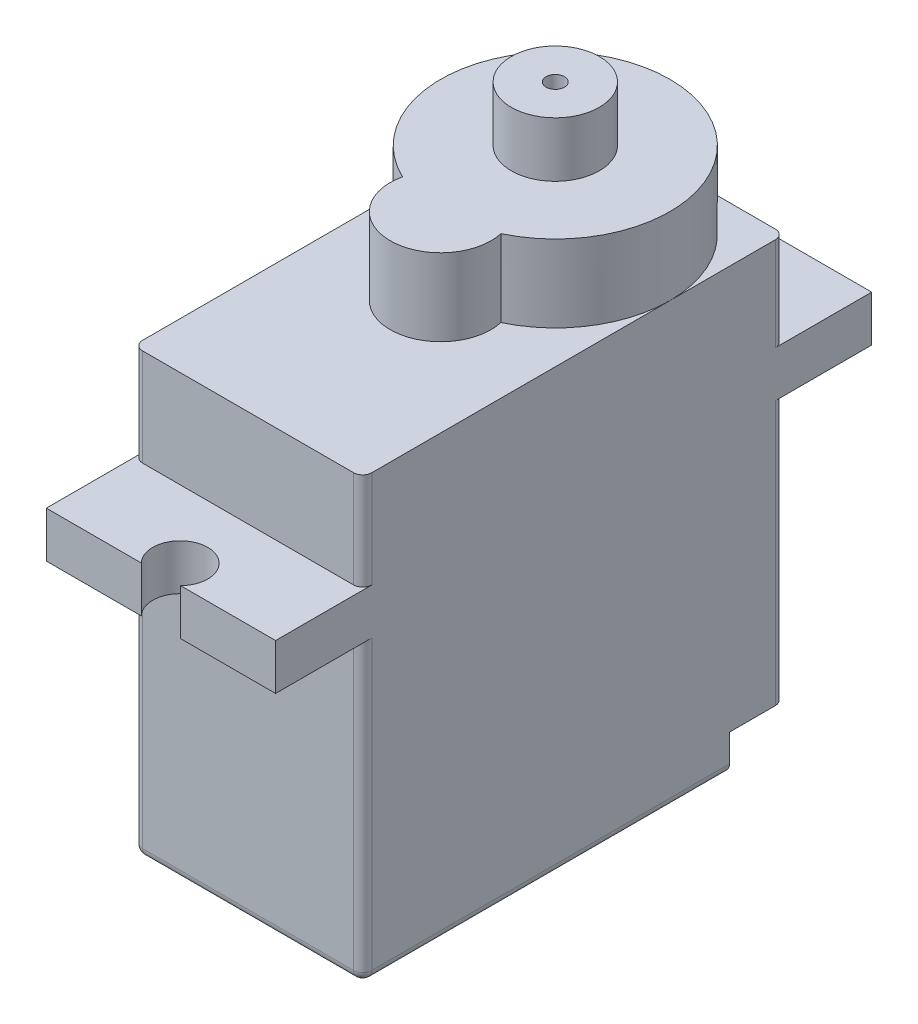
from build123d import *

# Parameters (mm, degrees)
SKETCH1_W                    = 32.5
SKETCH1_H                    = 24
BOSS_EXTRUDE1_DEPTH          = 12.5
BOSS_EXTRUDE2_DEPTH          = 4.2
SKETCH3_W                    = 4.75
SKETCH3_H                    = 5.1
CUT_EXTRUDE1_DEPTH           = 35.864774487
SKETCH4_W                    = 4.75
SKETCH4_H                    = 16.4
CUT_EXTRUDE2_DEPTH           = 35.864774487
SKETCH5_W                    = 4.75
SKETCH5_H                    = 5.3
CUT_EXTRUDE3_DEPTH           = 35.864774487
SKETCH6_W                    = 4.75
SKETCH6_H                    = 16.2
CUT_EXTRUDE4_DEPTH           = 35.864774487
SKETCH7_W                    = 2.3
SKETCH7_H                    = 3
CUT_EXTRUDE5_DEPTH           = 2
SKETCH8_W                    = 2.3
SKETCH8_H                    = 3
CUT_EXTRUDE6_DEPTH           = 2
SKETCH9_W                    = 2.4
SKETCH9_H                    = 3
F_3_0_3_DIAMETER_HOLE1_D     = 3
F_3_0_3_DIAMETER_HOLE1_DEPTH = 18.9
F_3_0_3_DIAMETER_HOLE2_D     = 3
F_3_0_3_DIAMETER_HOLE2_DEPTH = 18.7
F_1_0_1_DIAMETER_HOLE1_D     = 1
F_1_0_1_DIAMETER_HOLE1_DEPTH = 3
CHAMFER1_SIZE                = 2
CHAMFER1_SIZE2               = 3
FILLET1_R                    = 0.5


with BuildPart() as part:
    # Sketch1 → Boss-Extrude1 (new body)
    with BuildSketch(Plane(origin=(6.25, 0, 0), x_dir=(0, 0, -1), z_dir=(1, 0, 0))):
        with Locations((0, 12)):
            Rectangle(SKETCH1_W, SKETCH1_H)
    extrude(amount=-BOSS_EXTRUDE1_DEPTH)

    # Sketch2 → Boss-Extrude2 (add)
    with BuildSketch(Plane(origin=(0, 24, 0), x_dir=(-1, 0, 0), z_dir=(0, 1, 0))):
        with BuildLine():
            ThreePointArc((2.682624648, 0.395), (0, -11.5), (-2.682624648, 0.395))
            ThreePointArc((-2.682624648, 0.395), (0, 3.75), (2.682624648, 0.395))
        make_face()
    extrude(amount=BOSS_EXTRUDE2_DEPTH)

    # Sketch3 → Cut-Extrude1 (cut, through all)
    with BuildSketch(Plane(origin=(6.25, 0, 0), x_dir=(0, 0, -1), z_dir=(1, 0, 0))):
        with Locations((13.875, 21.45)):
            Rectangle(SKETCH3_W, SKETCH3_H)
    extrude(amount=-CUT_EXTRUDE1_DEPTH, mode=Mode.SUBTRACT)

    # Sketch4 → Cut-Extrude2 (cut, through all)
    with BuildSketch(Plane.ZY.offset(6.25)):
        with Locations((-13.875, 8.2)):
            Rectangle(SKETCH4_W, SKETCH4_H)
    extrude(amount=-CUT_EXTRUDE2_DEPTH, mode=Mode.SUBTRACT)

    # Sketch5 → Cut-Extrude3 (cut, through all)
    with BuildSketch(Plane.ZY.offset(6.25)):
        with Locations((13.875, 21.35)):
            Rectangle(SKETCH5_W, SKETCH5_H)
    extrude(amount=-CUT_EXTRUDE3_DEPTH, mode=Mode.SUBTRACT)

    # Sketch6 → Cut-Extrude4 (cut, through all)
    with BuildSketch(Plane.ZY.offset(6.25)):
        with Locations((13.875, 8.1)):
            Rectangle(SKETCH6_W, SKETCH6_H)
    extrude(amount=-CUT_EXTRUDE4_DEPTH, mode=Mode.SUBTRACT)

    # Sketch7 → Cut-Extrude5 (cut)
    with BuildSketch(Plane.XZ):
        with Locations((5.1, -10)):
            Rectangle(SKETCH7_W, SKETCH7_H)
    extrude(amount=-CUT_EXTRUDE5_DEPTH, mode=Mode.SUBTRACT)

    # Sketch8 → Cut-Extrude6 (cut)
    with BuildSketch(Plane.XZ):
        with Locations((-5.1, -10)):
            Rectangle(SKETCH8_W, SKETCH8_H)
    extrude(amount=-CUT_EXTRUDE6_DEPTH, mode=Mode.SUBTRACT)

    # Sketch9 → Revolve1 (revolve)
    with BuildSketch(Plane.XY.offset(-5.25), mode=Mode.PRIVATE) as revolve1_sk:
        with Locations((1.2, 29.7)):
            Rectangle(SKETCH9_W, SKETCH9_H)
    revolve(revolve1_sk.sketch.rotate(Axis((0, 31.2, -5.25), (0, -1, 0)), 270), axis=Axis((0, 31.2, -5.25), (0, -1, 0)))

    # Ø3.0 (3) Diameter Hole1
    with Locations(Plane(origin=(0, 18.9, 0), x_dir=(1, 0, 0), z_dir=(0, 1, 0))):
        with Locations((0, 15.2)):
            Hole(F_3_0_3_DIAMETER_HOLE1_D / 2, depth=F_3_0_3_DIAMETER_HOLE1_DEPTH)

    # Ø3.0 (3) Diameter Hole2
    with Locations(Plane(origin=(0, 18.7, 0), x_dir=(1, 0, 0), z_dir=(0, 1, 0))):
        with Locations((0, -15.2)):
            Hole(F_3_0_3_DIAMETER_HOLE2_D / 2, depth=F_3_0_3_DIAMETER_HOLE2_DEPTH)

    # Ø1.0 (1) Diameter Hole1
    with Locations(Plane(origin=(0, 31.2, 0), x_dir=(1, 0, 0), z_dir=(0, 1, 0))):
        with Locations((0, 5.25)):
            Hole(F_1_0_1_DIAMETER_HOLE1_D / 2, depth=F_1_0_1_DIAMETER_HOLE1_DEPTH)

    # Chamfer1
    chamfer1_edges = [part.edges().sort_by_distance(p)[0] for p in [
        (0, 0, -11.5),
    ]]
    chamfer1_side = [part.faces().sort_by_distance(p)[0] for p in [
        (0, 8.538304392, -11.5),
    ]]
    chamfer(chamfer1_edges, length=CHAMFER1_SIZE, length2=CHAMFER1_SIZE2, reference=chamfer1_side[0])

    # Fillet1
    fillet1_edges = [part.edges().sort_by_distance(p)[0] for p in [
        (-6.25, 9.2, -11.5),
        (-6.25, 21.45, -11.5),
        (6.25, 21.45, -11.5),
        (6.25, 21.35, 11.5),
        (-6.25, 21.35, 11.5),
        (6.25, 0, 1.5),
        (-6.25, 0, 1.5),
        (6.25, 8.1, 11.5),
        (0, 0, 11.5),
        (-6.25, 8.1, 11.5),
        (6.25, 9.2, -11.5),
    ]]
    fillet(fillet1_edges, radius=FILLET1_R)


solid = part.part
